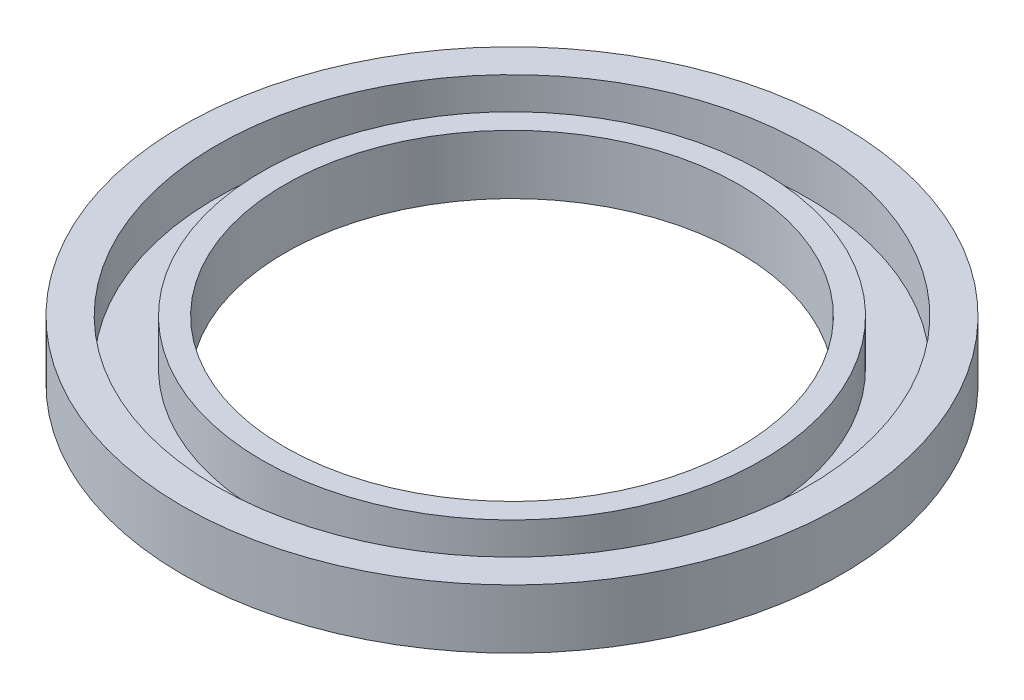
from build123d import *

# Parameters (mm, degrees)
SKETCH_1_R          = 72.5
SKETCH_1_R_2        = 50
EXTRUDE_1_DEPTH     = 13
SKETCH_2_R          = 65
SKETCH_2_R_2        = 55
CUT_EXTRUDE_1_DEPTH = 10


with BuildPart() as part:
    # 草图1 → 凸台-拉伸1 (new body)
    with BuildSketch(Plane(origin=(0, 0, 0), x_dir=(1, 0, 0), z_dir=(0, 1, 0))):
        with Locations(Location((0, 0, 0), (0, 0, 90))):
            Circle(SKETCH_1_R)
        with Locations(Location((0, 0, 0), (0, 0, 90))):
            Circle(SKETCH_1_R_2, mode=Mode.SUBTRACT)
    extrude(amount=EXTRUDE_1_DEPTH)

    # 草图2 → 切除-拉伸1 (cut)
    with BuildSketch(Plane(origin=(0, 13, 0), x_dir=(1, 0, 0), z_dir=(0, 1, 0))):
        with Locations(Location((0, 0, 0), (0, 0, 270))):
            Circle(SKETCH_2_R)
        with Locations(Location((0, 0, 0), (0, 0, 270))):
            Circle(SKETCH_2_R_2, mode=Mode.SUBTRACT)
    extrude(amount=-CUT_EXTRUDE_1_DEPTH, mode=Mode.SUBTRACT)


solid = part.part
